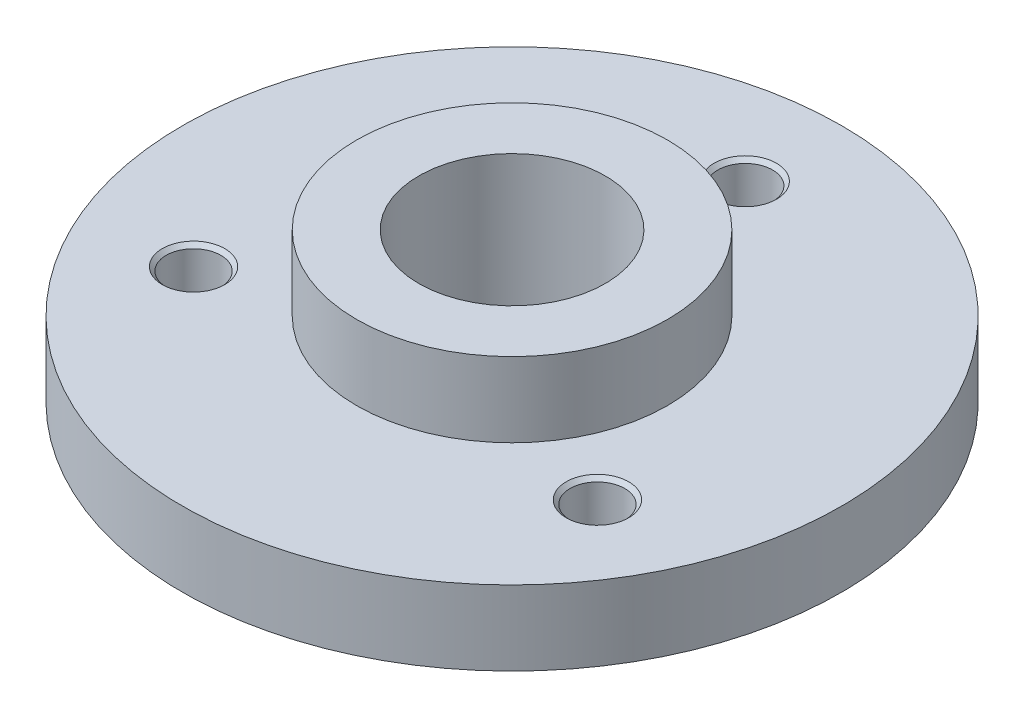
from build123d import *

# Parameters (mm, degrees)
HOLE1_D                           = 30
M10X1_25_TAPPED_HOLE1_D           = 8.8
M10X1_25_TAPPED_HOLE1_CSINK_D     = 10.05
M10X1_25_TAPPED_HOLE1_CSINK_ANGLE = 90
CIRPATTERN1_COUNT                 = 3


with BuildPart() as part:
    # Sketch1 → Revolve1 (revolve)
    with BuildSketch(Plane(origin=(0, 0, 0), x_dir=(0, 0, -1), z_dir=(1, 0, 0))):
        Polygon((0, 0), (0, 24), (25, 24), (25, 12), (53, 12), (53, 0), align=None)
    revolve(axis=Axis((0, 0, 0), (0, 1, 0)))

    # Hole1 (through all)
    with Locations(Plane(origin=(0, 24, 0), x_dir=(1, 0, 0), z_dir=(0, 1, 0))):
        with Locations((0, 0)):
            Hole(HOLE1_D / 2)

    # M10x1.25 Tapped Hole1 (through all)
    with Locations(Plane(origin=(0, 12, 0), x_dir=(1, 0, 0), z_dir=(0, 1, 0))):
        with Locations((0, 37.5)):
            m10x1_25_tapped_hole1 = CounterSinkHole(M10X1_25_TAPPED_HOLE1_D / 2, M10X1_25_TAPPED_HOLE1_CSINK_D / 2, counter_sink_angle=M10X1_25_TAPPED_HOLE1_CSINK_ANGLE)

    # CirPattern1: M10x1.25 Tapped Hole1 ×3 about axis
    cirpattern1_axis = Axis((0, 0, 0), (0, 1, 0))
    for i in range(1, CIRPATTERN1_COUNT):
        add(m10x1_25_tapped_hole1.rotate(cirpattern1_axis, i * 360 / CIRPATTERN1_COUNT), mode=Mode.SUBTRACT)


solid = part.part
